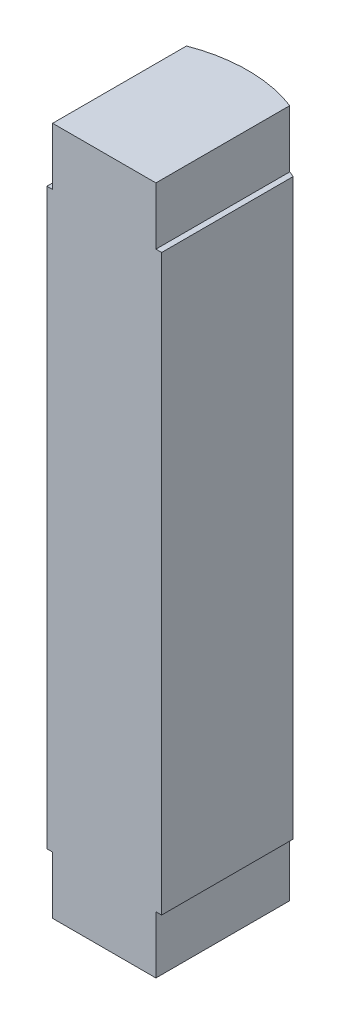
from build123d import *

# Parameters (mm, degrees)
BOSS_EXTRUDE1_DEPTH = 60
SKETCH3_W           = 0.5
SKETCH3_H           = 5
CUT_EXTRUDE1_DEPTH  = 20


with BuildPart() as part:
    # Sketch2 → Boss-Extrude1 (new body)
    with BuildSketch(Plane(origin=(0, 0, 0), x_dir=(1, 0, 0), z_dir=(0, 1, 0))):
        with BuildLine():
            Line((-5, 0), (5, 0))
            Line((5, 0), (5, 11.456439237))
            ThreePointArc((5, 11.456439237), (0, 12.5), (-5, 11.456439237))
            Line((-5, 11.456439237), (-5, 0))
        make_face()
    extrude(amount=BOSS_EXTRUDE1_DEPTH)

    # Sketch3 → Cut-Extrude1 (cut)
    with BuildSketch(Plane.XY):
        with Locations((-4.75, 2.5)):
            Rectangle(SKETCH3_W, SKETCH3_H)
        with Locations((4.75, 2.5)):
            Rectangle(SKETCH3_W, SKETCH3_H)
        with Locations((4.75, 57.5)):
            Rectangle(SKETCH3_W, SKETCH3_H)
        with Locations((-4.75, 57.5)):
            Rectangle(SKETCH3_W, SKETCH3_H)
    extrude(amount=-CUT_EXTRUDE1_DEPTH, mode=Mode.SUBTRACT)


solid = part.part
